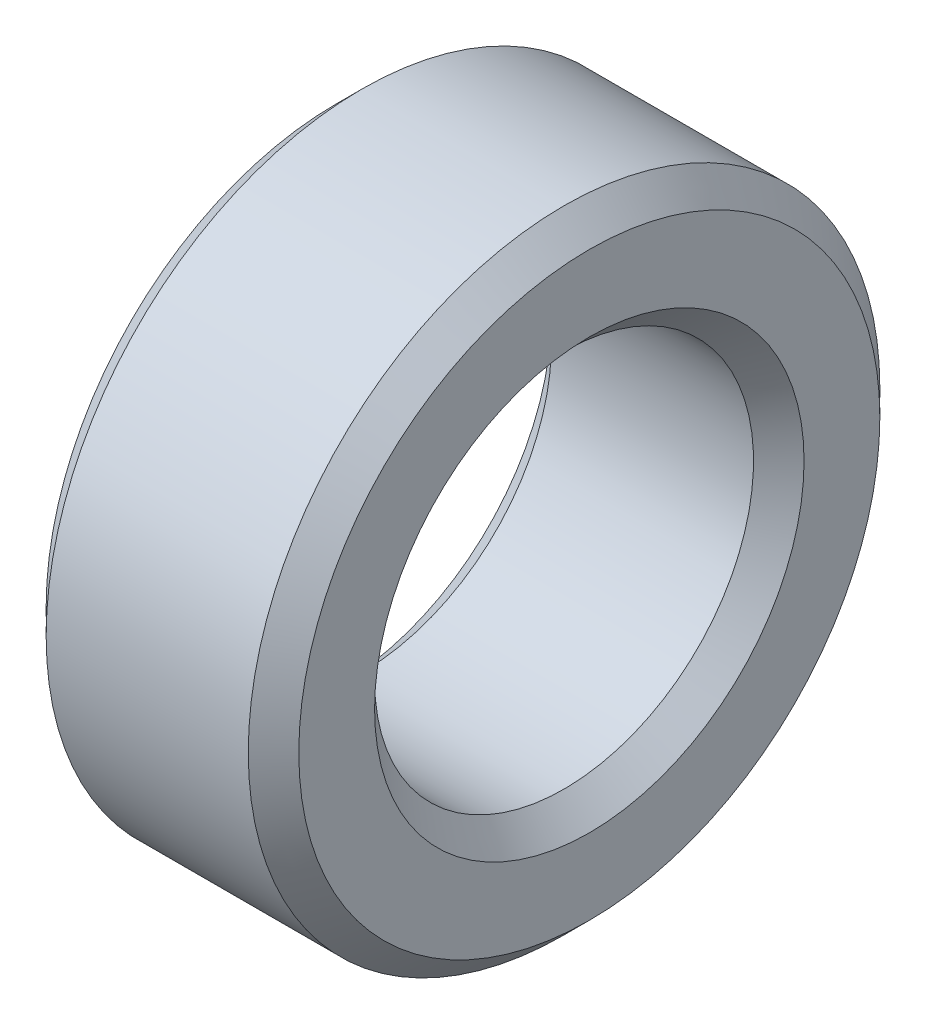
from build123d import *

# Parameters (mm, degrees)
SKETCH1_W     = 2
SKETCH1_H     = 1
CHAMFER1_SIZE = 0.2


with BuildPart() as part:
    # Sketch1 → Revolve1 (revolve)
    with BuildSketch(Plane.XY, mode=Mode.PRIVATE) as revolve1_sk:
        with Locations((1, 2)):
            Rectangle(SKETCH1_W, SKETCH1_H)
    revolve(revolve1_sk.sketch.rotate(Axis((0, 0, 0), (1, 0, 0)), 90), axis=Axis((0, 0, 0), (1, 0, 0)))

    # Chamfer1
    chamfer1_edges = [part.edges().sort_by_distance(p)[0] for p in [
        (0, 0, -1.5),
        (2, 0, -1.5),
        (2, 0, -2.5),
        (0, 0, -2.5),
    ]]
    chamfer(chamfer1_edges, length=CHAMFER1_SIZE)


solid = part.part
